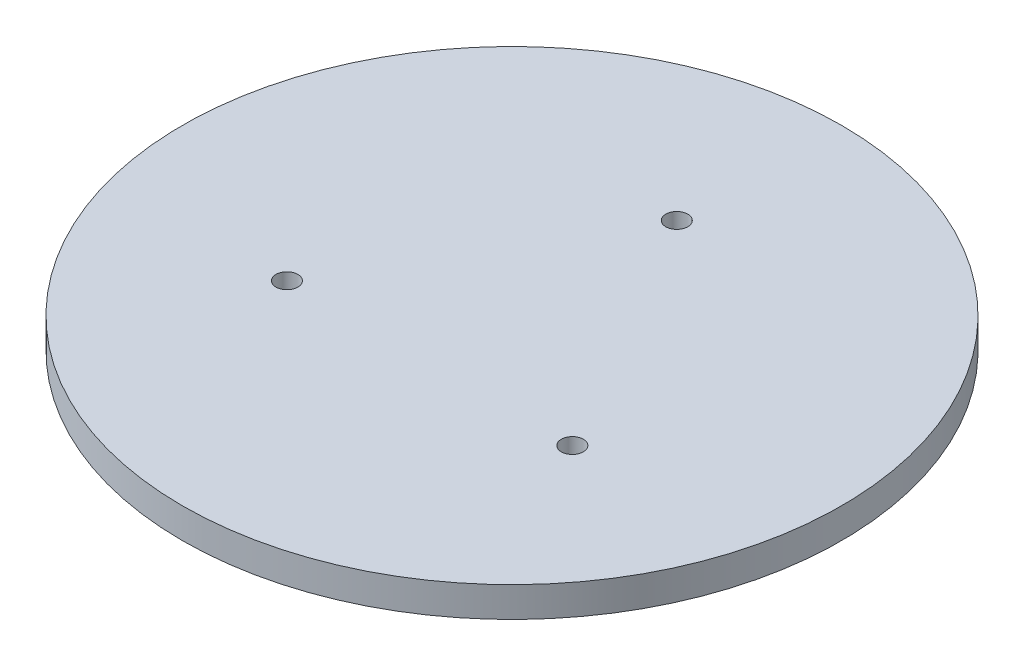
from build123d import *

# Parameters (mm, degrees)
SKETCH1_R           = 69.342
SKETCH1_R_2         = 2.3114
BOSS_EXTRUDE1_DEPTH = 6.35


with BuildPart() as part:
    # Sketch1 → Boss-Extrude1 (new body)
    with BuildSketch(Plane(origin=(0, 0, 0), x_dir=(1, 0, 0), z_dir=(0, 1, 0))):
        with Locations(Location((0, 0, 0), (0, 0, 270))):
            Circle(SKETCH1_R)
        with Locations(Location((0, 34.671, 0), (0, 0, 270))):
            Circle(SKETCH1_R_2, mode=Mode.SUBTRACT)
        with Locations(Location((30.025966775, -17.3355, 0), (0, 0, 270))):
            Circle(SKETCH1_R_2, mode=Mode.SUBTRACT)
        with Locations(Location((-30.025966775, -17.3355, 0), (0, 0, 270))):
            Circle(SKETCH1_R_2, mode=Mode.SUBTRACT)
    extrude(amount=BOSS_EXTRUDE1_DEPTH)


solid = part.part
